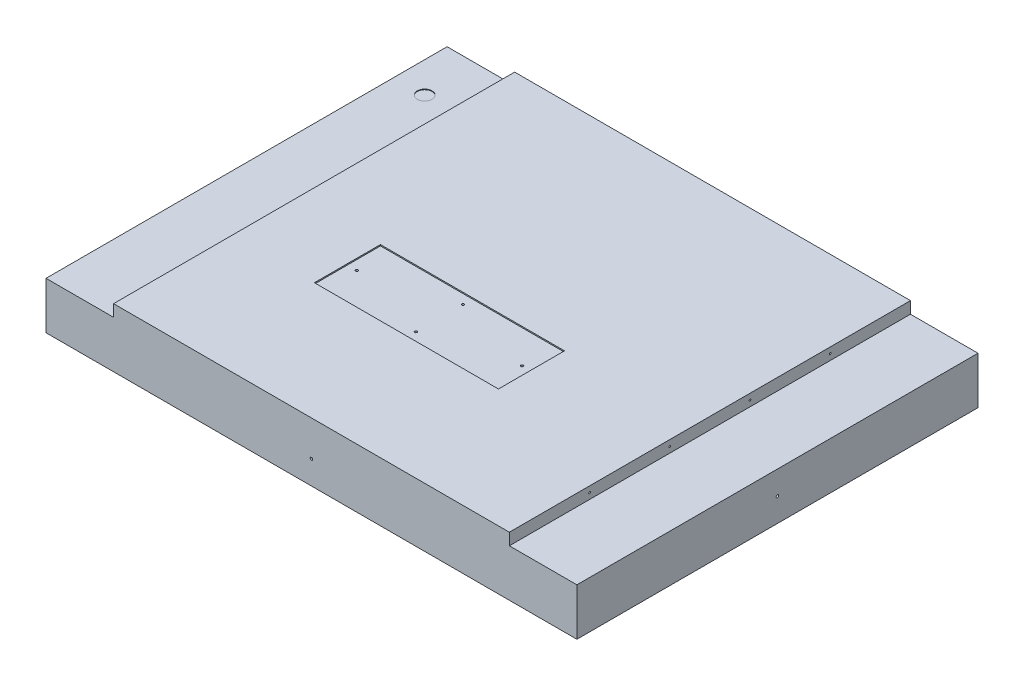
from build123d import *

# Parameters (mm, degrees)
SKETCH_1_W                    = 900
SKETCH_1_H                    = 680
EXTRUDE_1_DEPTH               = 80
SKETCH_2_W                    = 671
SKETCH_2_H                    = 680
EXTRUDE_2_DEPTH               = 20
SKETCH_4_W                    = 312
SKETCH_4_H                    = 112
CUT_EXTRUDE_1_DEPTH           = 2
HOLE_WIZARD_M5_1_D            = 4.2
HOLE_WIZARD_M5_1_DEPTH        = 9
HOLE_WIZARD_M5_1_TIP          = 1.2618073
HOLE_WIZARD_M5_2_D            = 4.2
HOLE_WIZARD_M5_3_D            = 4.2
SKETCH_15_R                   = 12.5
CUT_EXTRUDE_2_DEPTH           = 1
HOLE_WIZARD_M3_5_1_AT_2_COUNT = 2
HOLE_WIZARD_M3_5_1_AT_2_PITCH = 136
HOLE_WIZARD_M3_5_1_AT_3_COUNT = 2
HOLE_WIZARD_M3_5_1_AT_3_PITCH = 272
HOLE_WIZARD_M3_5_1_AT_4_COUNT = 2
HOLE_WIZARD_M3_5_1_AT_4_PITCH = 408


with BuildPart() as part:
    # 草图1 → 凸台-拉伸1 (new body)
    with BuildSketch(Plane(origin=(0, 0, 0), x_dir=(1, 0, 0), z_dir=(0, 1, 0))):
        Rectangle(SKETCH_1_W, SKETCH_1_H)
    extrude(amount=EXTRUDE_1_DEPTH)

    # 草图2 → 凸台-拉伸2 (add)
    with BuildSketch(Plane(origin=(0, 80, 0), x_dir=(1, 0, 0), z_dir=(0, 1, 0))):
        Rectangle(SKETCH_2_W, SKETCH_2_H)
    extrude(amount=EXTRUDE_2_DEPTH)

    # 草图4 → 切除-拉伸1 (cut)
    with BuildSketch(Plane(origin=(0, 100, 0), x_dir=(1, 0, 0), z_dir=(0, 1, 0))):
        with Locations((-40, -83)):
            Rectangle(SKETCH_4_W, SKETCH_4_H)
    extrude(amount=-CUT_EXTRUDE_1_DEPTH, mode=Mode.SUBTRACT)

    # M5 螺纹孔1
    with Locations(Plane(origin=(0, 100, 0), x_dir=(1, 0, 0), z_dir=(0, 1, 0))):
        with Locations((-180, -83), (-40, -43), (-40, -123), (100, -83)):
            Hole(HOLE_WIZARD_M5_1_D / 2, depth=HOLE_WIZARD_M5_1_DEPTH)
            with Locations((0, 0, -(HOLE_WIZARD_M5_1_DEPTH + HOLE_WIZARD_M5_1_TIP / 2))):  # 118° drill point
                Cone(0, HOLE_WIZARD_M5_1_D / 2, HOLE_WIZARD_M5_1_TIP, mode=Mode.SUBTRACT)

    # M5 螺纹孔2 (through all)
    with Locations(Plane.XY.offset(340)):
        with Locations((0, 40)):
            Hole(HOLE_WIZARD_M5_2_D / 2)

    # M5 螺纹孔3 (through all)
    with Locations(Plane.ZY.offset(450)):
        with Locations((0, 40)):
            Hole(HOLE_WIZARD_M5_3_D / 2)

    # 草图15 → 切除-拉伸2 (cut)
    with BuildSketch(Plane(origin=(0, 80, 0), x_dir=(1, 0, 0), z_dir=(0, 1, 0))):
        with Locations(Location((-398, 250, 0), (0, 0, 270))):
            Circle(SKETCH_15_R)
    extrude(amount=-CUT_EXTRUDE_2_DEPTH, mode=Mode.SUBTRACT)

    # 草图19 → M3.5 螺纹孔1 (revolve, cut)
    with BuildSketch(Plane(origin=(-335.5, 90, -204), x_dir=(0, 0, 1), z_dir=(0, 1, 0))):
        Polygon((0, 0), (0, 8.271247898), (1.45, 7.4), (1.45, 0), align=None)
    hole_wizard_m3_5_1 = revolve(axis=Axis((-341.85, 90, -204), (1, 0, 0)), mode=Mode.SUBTRACT)

    # M3.5 螺纹孔1 at 2: M3.5 螺纹孔1 ×2
    with Locations(*[(0, 0, i * HOLE_WIZARD_M3_5_1_AT_2_PITCH) for i in range(1, HOLE_WIZARD_M3_5_1_AT_2_COUNT)]):
        add(hole_wizard_m3_5_1, mode=Mode.SUBTRACT)

    # M3.5 螺纹孔1 at 3: M3.5 螺纹孔1 ×2
    with Locations(*[(0, 0, i * HOLE_WIZARD_M3_5_1_AT_3_PITCH) for i in range(1, HOLE_WIZARD_M3_5_1_AT_3_COUNT)]):
        add(hole_wizard_m3_5_1, mode=Mode.SUBTRACT)

    # M3.5 螺纹孔1 at 4: M3.5 螺纹孔1 ×2
    with Locations(*[(0, 0, i * HOLE_WIZARD_M3_5_1_AT_4_PITCH) for i in range(1, HOLE_WIZARD_M3_5_1_AT_4_COUNT)]):
        add(hole_wizard_m3_5_1, mode=Mode.SUBTRACT)

    # 镜向1: M3.5 螺纹孔1 across plane
    add(hole_wizard_m3_5_1.mirror(Plane(origin=(0, 0, 0), x_dir=(0, 0, 1), z_dir=(1, 0, 0))), mode=Mode.SUBTRACT)

    # 镜向1 copy 1 sketch → 镜向1 copy 1 (revolve, cut)
    with BuildSketch(Plane(origin=(335.5, 90, -68), x_dir=(0, 0, 1), z_dir=(0, 1, 0))):
        Polygon((0, 0), (0, -8.271247898), (1.45, -7.4), (1.45, 0), align=None)
    revolve(axis=Axis((341.85, 90, -68), (1, 0, 0)), mode=Mode.SUBTRACT)

    # 镜向1 copy 2 sketch → 镜向1 copy 2 (revolve, cut)
    with BuildSketch(Plane(origin=(335.5, 90, 68), x_dir=(0, 0, 1), z_dir=(0, 1, 0))):
        Polygon((0, 0), (0, -8.271247898), (1.45, -7.4), (1.45, 0), align=None)
    revolve(axis=Axis((341.85, 90, 68), (1, 0, 0)), mode=Mode.SUBTRACT)

    # 镜向1 copy 3 sketch → 镜向1 copy 3 (revolve, cut)
    with BuildSketch(Plane(origin=(335.5, 90, 204), x_dir=(0, 0, 1), z_dir=(0, 1, 0))):
        Polygon((0, 0), (0, -8.271247898), (1.45, -7.4), (1.45, 0), align=None)
    revolve(axis=Axis((341.85, 90, 204), (1, 0, 0)), mode=Mode.SUBTRACT)


solid = part.part
